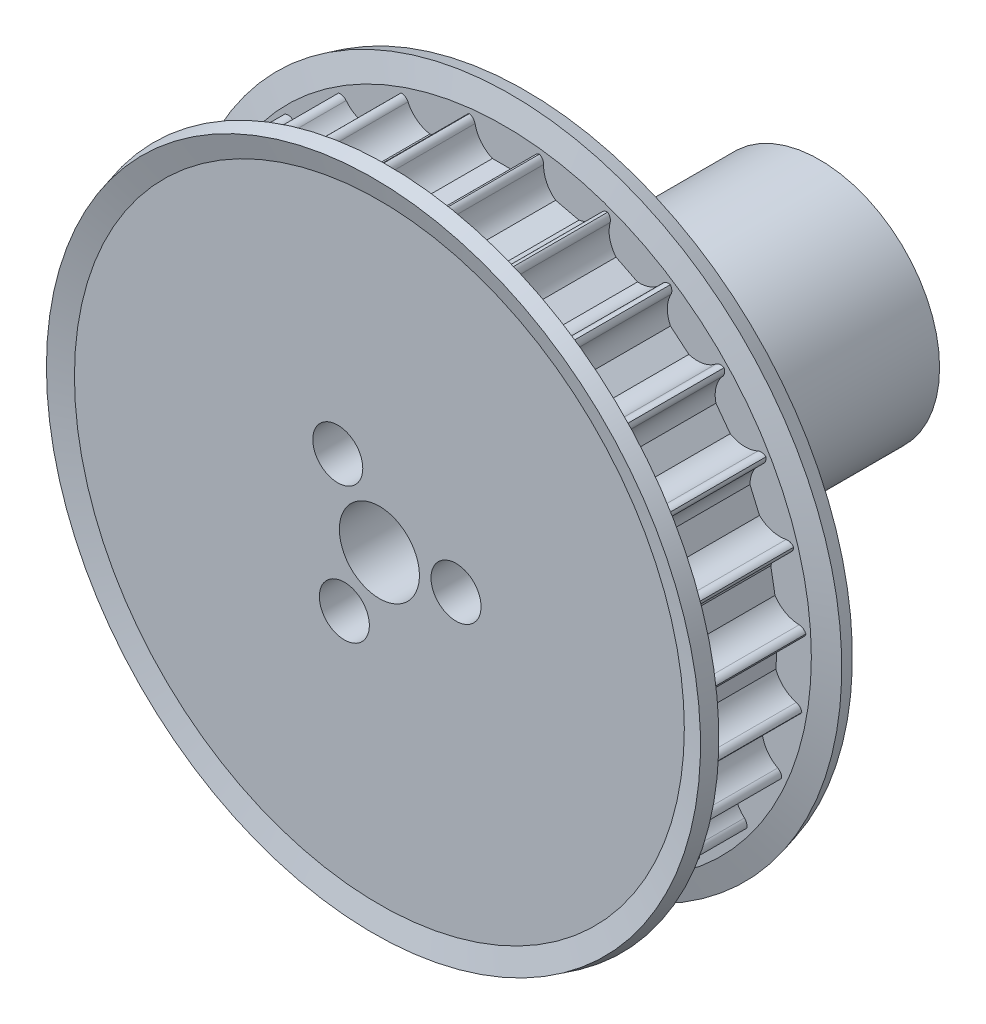
from build123d import *

# Parameters (mm, degrees)
CUT_EXTRUDE1_DEPTH = 63.112800613
CIRPATTERN1_COUNT  = 27
SKETCH4_R          = 2.5
CUT_EXTRUDE2_DEPTH = 65.630326609


with BuildPart() as part:
    # Sketch1 → Revolve1 (revolve)
    with BuildSketch(Plane(origin=(0, 0, 0), x_dir=(0, 0, -1), z_dir=(1, 0, 0)), mode=Mode.PRIVATE) as revolve1_sk:
        Polygon((0, 4), (0, 31), (14, 31), (14, 12), (44, 12), (44, 4), align=None)
    revolve(revolve1_sk.sketch.rotate(Axis((0, 0, -88.99), (0, 0, 1)), 90), axis=Axis((0, 0, -88.99), (0, 0, 1)))

    # Sketch2 → Cut-Extrude1 (cut, through all)
    with BuildSketch(Plane.XY):
        with BuildLine():
            Line((3.674234614, 30), (3.75, 30))
            Line((3.75, 30), (3.75, 32))
            Line((3.75, 32), (-3.75, 32))
            Line((-3.75, 32), (-3.75, 30))
            Line((-3.75, 30), (-3.674234614, 30))
            ThreePointArc((-3.674234614, 30), (-3.199892965, 29.830947502), (-2.939387691, 29.4))
            ThreePointArc((-2.939387691, 29.4), (-2.331759211, 28.112435701), (-1.198957881, 27.25))
            Line((-1.198957881, 27.25), (1.198957881, 27.25))
            ThreePointArc((1.198957881, 27.25), (2.331759211, 28.112435701), (2.939387691, 29.4))
            ThreePointArc((2.939387691, 29.4), (3.199892965, 29.830947502), (3.674234614, 30))
        make_face()
    cut_extrude1 = extrude(amount=-CUT_EXTRUDE1_DEPTH, mode=Mode.SUBTRACT)

    # CirPattern1: Cut-Extrude1 ×27 about axis
    cirpattern1_axis = Axis((0, 0, 0), (0, 0, 1))
    for i in range(1, CIRPATTERN1_COUNT):
        add(cut_extrude1.rotate(cirpattern1_axis, i * 360 / CIRPATTERN1_COUNT), mode=Mode.SUBTRACT)

    # Sketch3 → Revolve3 (revolve)
    with BuildSketch(Plane(origin=(0, 0, 0), x_dir=(0, 0, -1), z_dir=(1, 0, 0)), mode=Mode.PRIVATE) as revolve3_sk:
        Polygon((0, 30.482995966), (0, 27.241490762), (1.5, 27.241490762), (1.5, 30.680474712), (0.856921938, 33.080474712), (-0.591966801, 32.692246144), align=None)
        Polygon((14.591966801, 32.692246144), (13.143078062, 33.080474712), (12.5, 30.680474712), (12.5, 27.241490762), (14, 27.241490762), (14, 30.482995966), align=None)
    revolve(revolve3_sk.sketch.rotate(Axis((0, 0, -88.99), (0, 0, 1)), 90), axis=Axis((0, 0, -88.99), (0, 0, 1)))

    # Sketch4 → Cut-Extrude2 (cut, through all)
    with BuildSketch(Plane(origin=(0, 0, -44), x_dir=(-1, 0, 0), z_dir=(0, 0, -1))):
        with Locations((-7.660672471, 0.380266901)):
            Circle(SKETCH4_R)
        with Locations((4.159657032, 6.444203519)):
            Circle(SKETCH4_R)
        with Locations((3.501015438, -6.82447042)):
            Circle(SKETCH4_R)
    extrude(amount=-CUT_EXTRUDE2_DEPTH, mode=Mode.SUBTRACT)


solid = part.part
